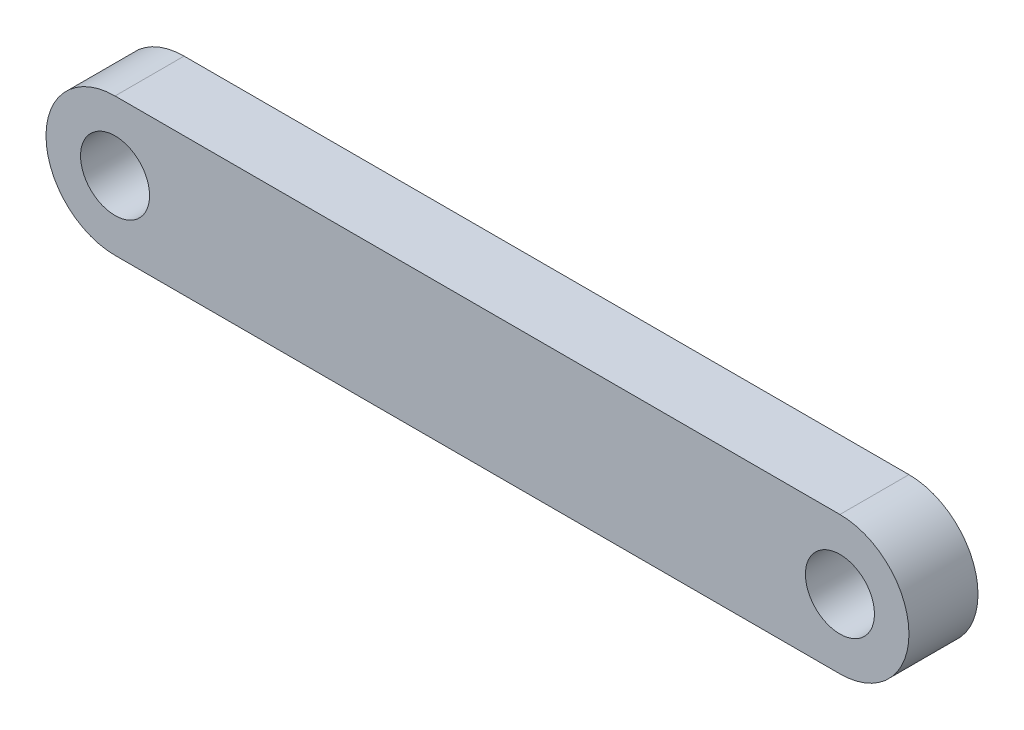
from build123d import *

# Parameters (mm, degrees)
SKETCH1_R           = 10
BOSS_EXTRUDE1_DEPTH = 20


with BuildPart() as part:
    # Sketch1 → Boss-Extrude1 (new body)
    with BuildSketch(Plane.XY):
        with BuildLine():
            Line((0, 20), (210, 20))
            ThreePointArc((210, 20), (230, 0), (210, -20))
            Line((210, -20), (0, -20))
            ThreePointArc((0, -20), (-20, 0), (0, 20))
        make_face()
        Circle(SKETCH1_R, mode=Mode.SUBTRACT)
        with Locations((210, 0)):
            Circle(SKETCH1_R, mode=Mode.SUBTRACT)
    extrude(amount=BOSS_EXTRUDE1_DEPTH)


solid = part.part
